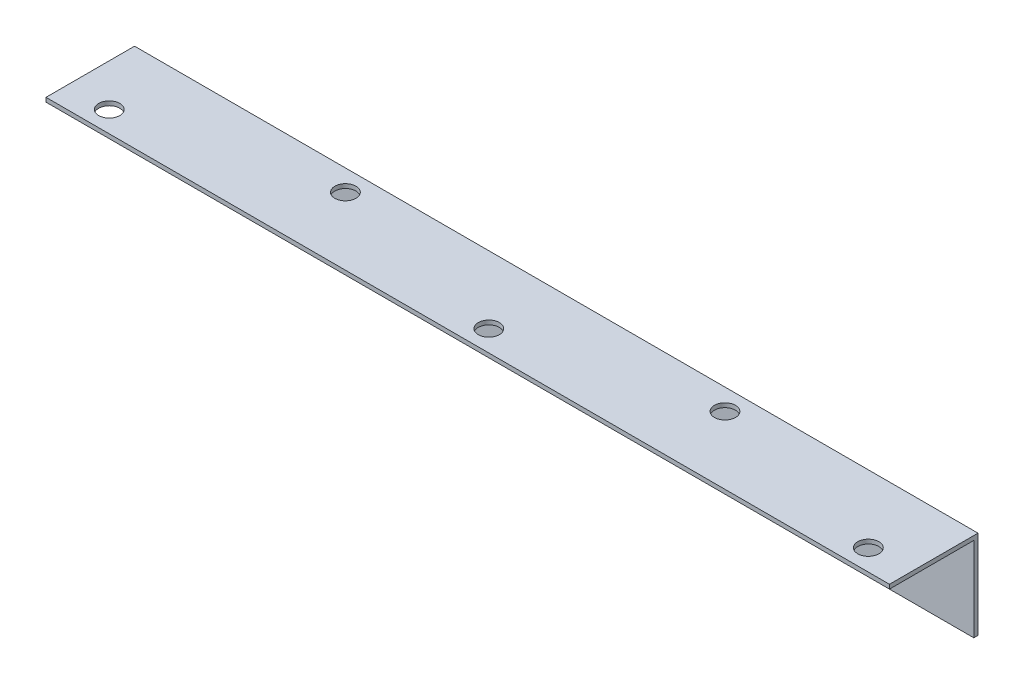
from build123d import *

# Parameters (mm, degrees)
SKETCH1_W           = 200
SKETCH1_H           = 20
BOSS_EXTRUDE1_DEPTH = 1
SKETCH4_W           = 200
SKETCH4_H           = 21
SKETCH4_R           = 2.5
BOSS_EXTRUDE2_DEPTH = 1
SKETCH5_R           = 4
CUT_EXTRUDE1_DEPTH  = 10


with BuildPart() as part:
    # Sketch1 → Boss-Extrude1 (new body)
    with BuildSketch(Plane.XY):
        with Locations((-100, 10)):
            Rectangle(SKETCH1_W, SKETCH1_H)
    extrude(amount=BOSS_EXTRUDE1_DEPTH)

    # Sketch4 → Boss-Extrude2 (add)
    with BuildSketch(Plane(origin=(0, 20, 0), x_dir=(1, 0, 0), z_dir=(0, 1, 0))):
        with Locations((-100, -10.5)):
            Rectangle(SKETCH4_W, SKETCH4_H)
        with Locations(Location((-190, -16, 0), (0, 0, 270))):
            Circle(SKETCH4_R, mode=Mode.SUBTRACT)
        with Locations(Location((-145, -5, 0), (0, 0, 270))):
            Circle(SKETCH4_R, mode=Mode.SUBTRACT)
        with Locations(Location((-100, -16, 0), (0, 0, 270))):
            Circle(SKETCH4_R, mode=Mode.SUBTRACT)
        with Locations(Location((-55, -5, 0), (0, 0, 270))):
            Circle(SKETCH4_R, mode=Mode.SUBTRACT)
        with Locations(Location((-10, -16, 0), (0, 0, 270))):
            Circle(SKETCH4_R, mode=Mode.SUBTRACT)
    extrude(amount=BOSS_EXTRUDE2_DEPTH)

    # Sketch5 → Cut-Extrude1 (cut)
    with BuildSketch(Plane.XY.offset(1)):
        with Locations((-140, 9.372455226)):
            Circle(SKETCH5_R)
        with Locations((-60, 9.372455226)):
            Circle(SKETCH5_R)
    extrude(amount=-CUT_EXTRUDE1_DEPTH, mode=Mode.SUBTRACT)


solid = part.part
